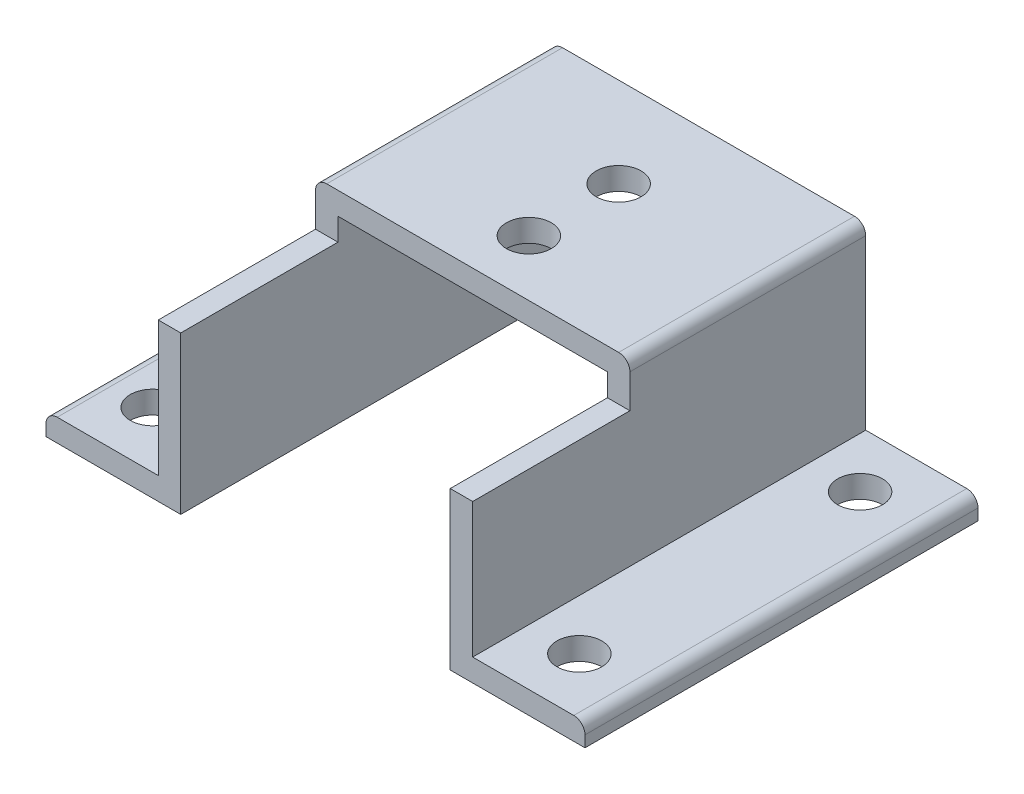
from build123d import *

# Parameters (mm, degrees)
BOSS_EXTRUDE1_DEPTH = 35
SKETCH3_W           = 28
SKETCH3_H           = 14
CUT_EXTRUDE1_DEPTH  = 4
FILLET1_R           = 1
SKETCH4_R           = 2
CUT_EXTRUDE2_DEPTH  = 63.072538211


with BuildPart() as part:
    # Sketch2 → Boss-Extrude1 (new body)
    with BuildSketch(Plane.XY):
        Polygon((0, 0), (0, 2), (10, 2), (10, 18), (38, 18), (38, 2), (48, 2), (48, 0), (36, 0), (36, 16), (12, 16), (12, 0), align=None)
    extrude(amount=BOSS_EXTRUDE1_DEPTH)

    # Sketch3 → Cut-Extrude1 (cut)
    with BuildSketch(Plane(origin=(0, 18, 0), x_dir=(1, 0, 0), z_dir=(0, 1, 0))):
        with Locations((24, -28)):
            Rectangle(SKETCH3_W, SKETCH3_H)
    extrude(amount=-CUT_EXTRUDE1_DEPTH, mode=Mode.SUBTRACT)

    # Fillet1
    fillet1_edges = [part.edges().sort_by_distance(p)[0] for p in [
        (0, 2, 17.5),
        (48, 2, 17.5),
        (10, 18, 10.5),
        (38, 18, 10.5),
    ]]
    fillet(fillet1_edges, radius=FILLET1_R)

    # Sketch4 → Cut-Extrude2 (cut, through all)
    with BuildSketch(Plane(origin=(0, 18, 0), x_dir=(1, 0, 0), z_dir=(0, 1, 0))):
        with Locations(Location((24, -8, 0), (0, 0, 270))):
            Circle(SKETCH4_R)
        with Locations(Location((24, -16, 0), (0, 0, 270))):
            Circle(SKETCH4_R)
        with Locations(Location((42.5, -5, 0), (0, 0, 270))):
            Circle(SKETCH4_R)
        with Locations(Location((42.5, -30, 0), (0, 0, 270))):
            Circle(SKETCH4_R)
        with Locations(Location((4.5, -5, 0), (0, 0, 270))):
            Circle(SKETCH4_R)
        with Locations(Location((4.5, -30, 0), (0, 0, 270))):
            Circle(SKETCH4_R)
    extrude(amount=-CUT_EXTRUDE2_DEPTH, mode=Mode.SUBTRACT)


solid = part.part
